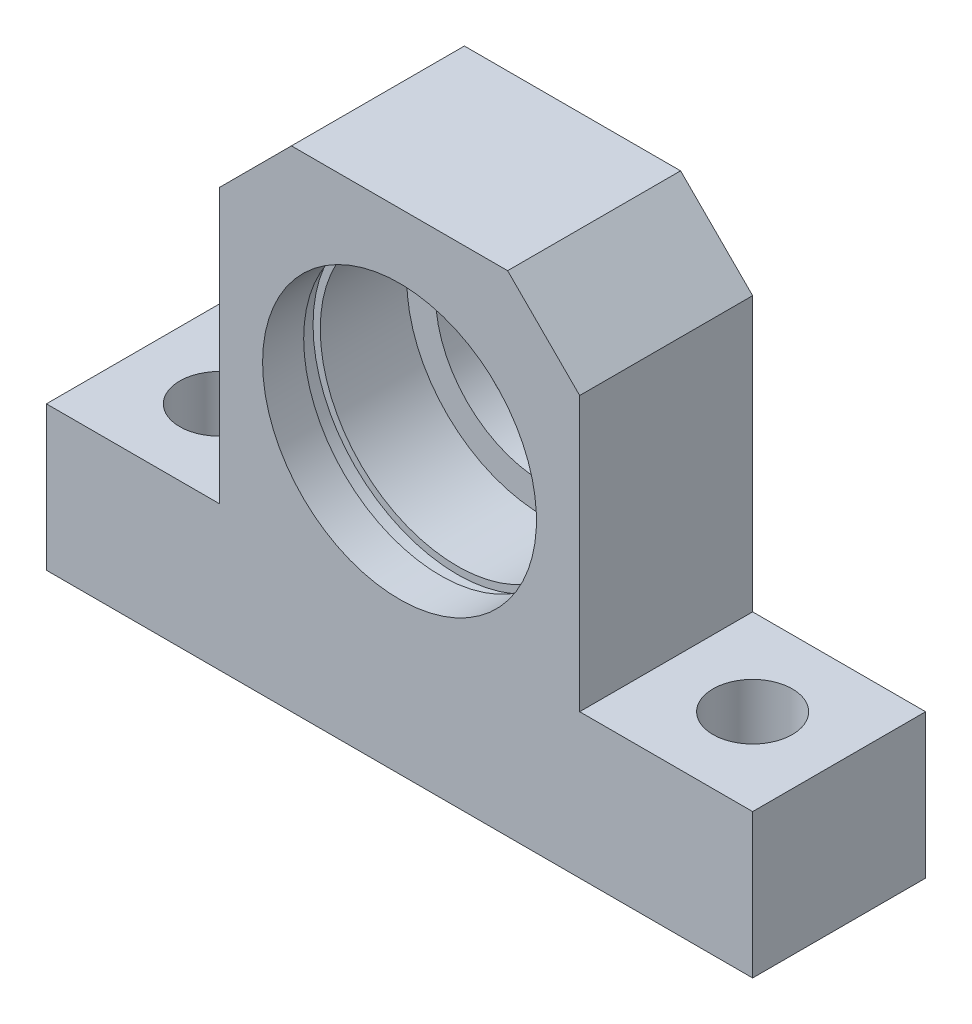
from build123d import *

# Parameters (mm, degrees)
BOSS_EXTRUDE1_DEPTH = 12
DIAMETER_HOLE1_D    = 5.5
CHAMFER1_SIZE       = 5


with BuildPart() as part:
    # Sketch1 → Boss-Extrude1 (new body)
    with BuildSketch(Plane.XY):
        Polygon((-12.5, 34), (12.5, 34), (12.5, 10), (24.5, 10), (24.5, 0), (-24.5, 0), (-24.5, 10), (-12.5, 10), align=None)
    extrude(amount=-BOSS_EXTRUDE1_DEPTH)

    # Sketch2 → Cut-Revolve1 (revolve, cut)
    with BuildSketch(Plane(origin=(0, 0, 0), x_dir=(0, 0, -1), z_dir=(1, 0, 0))):
        Polygon((2.85, 29.5), (2.85, 30), (4, 30), (4, 29.5), (10, 29.5), (10, 27.5), (12, 27.5), (12, 20), (0, 20), (0, 29.5), align=None)
    revolve(axis=Axis((0, 20, -12), (0, 0, 1)), mode=Mode.SUBTRACT)

    # Diameter Hole1 (through all)
    with Locations(Plane(origin=(0, 10, 0), x_dir=(1, 0, 0), z_dir=(0, 1, 0))):
        with Locations((-18.5, 6), (18.5, 6)):
            Hole(DIAMETER_HOLE1_D / 2)

    # Chamfer1
    chamfer1_edges = [part.edges().sort_by_distance(p)[0] for p in [
        (-12.5, 34, -6),
        (12.5, 34, -6),
    ]]
    chamfer(chamfer1_edges, length=CHAMFER1_SIZE)


solid = part.part
